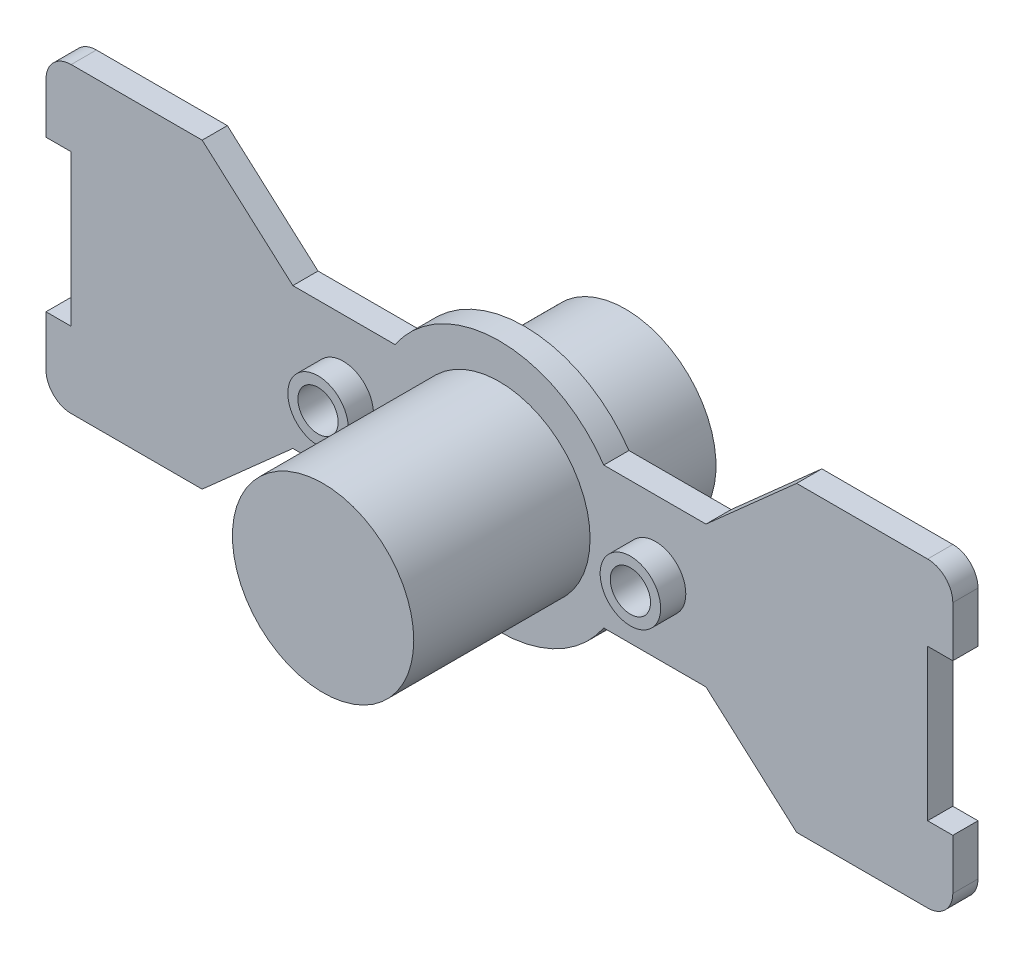
from build123d import *

# Parameters (mm, degrees)
EXTRUDE_1_DEPTH     = 5
SKETCH_2_R          = 18
EXTRUDE_2_DEPTH     = 35
EXTRUDE_START       = 20
SKETCH_3_R          = 18
EXTRUDE_3_DEPTH     = 20
SKETCH_4_R          = 15
CUT_EXTRUDE_1_DEPTH = 55
SKETCH_5_R          = 6
SKETCH_5_R_2        = 4
EXTRUDE_4_DEPTH     = 5
CUT_EXTRUDE_2_REACH = 103.119
SKETCH_6_R          = 4
FILLET_1_R          = 5


with BuildPart() as part:
    # 草图1 → 凸台-拉伸1 (new body)
    with BuildSketch(Plane.XY):
        with BuildLine():
            Line((-20.712315177, 14), (-41, 14))
            Line((-41, 14), (-59, 30))
            Line((-59, 30), (-90, 30))
            Line((-90, 30), (-90, 15))
            Line((-90, 15), (-85, 15))
            Line((-85, 15), (-85, -15))
            Line((-85, -15), (-90, -15))
            Line((-90, -15), (-90, -30))
            Line((-90, -30), (-59, -30))
            Line((-59, -30), (-41, -14))
            Line((-41, -14), (-20.712315177, -14))
            ThreePointArc((-20.712315177, -14), (0, -25), (20.712315177, -14))
            Line((20.712315177, -14), (41, -14))
            Line((41, -14), (59, -30))
            Line((59, -30), (90, -30))
            Line((90, -30), (90, -15))
            Line((90, -15), (85, -15))
            Line((85, -15), (85, 15))
            Line((85, 15), (90, 15))
            Line((90, 15), (90, 30))
            Line((90, 30), (59, 30))
            Line((59, 30), (41, 14))
            Line((41, 14), (20.712315177, 14))
            ThreePointArc((20.712315177, 14), (0, 25), (-20.712315177, 14))
        make_face()
    extrude(amount=EXTRUDE_1_DEPTH)

    # 草图2 → 凸台-拉伸2 (add)
    with BuildSketch(Plane.XY.offset(5)):
        Circle(SKETCH_2_R)
    extrude(amount=EXTRUDE_2_DEPTH)

    # 草图3 → 凸台-拉伸3 (add)
    with BuildSketch(Plane(origin=(0, 0, 0), x_dir=(-1, 0, 0), z_dir=(0, 0, -1)).offset(EXTRUDE_START)):
        with Locations(Location((0, 0, 0), (0, 0, 180))):
            Circle(SKETCH_3_R)
    extrude(amount=-EXTRUDE_3_DEPTH)

    # 草图4 → 切除-拉伸1 (cut)
    with BuildSketch(Plane(origin=(0, 0, -20), x_dir=(-1, 0, 0), z_dir=(0, 0, -1))):
        Circle(SKETCH_4_R)
    extrude(amount=-CUT_EXTRUDE_1_DEPTH, mode=Mode.SUBTRACT)

    # 草图5 → 凸台-拉伸4 (add)
    # profile 1 of 2: a face of its own
    with BuildSketch(Plane.XY.offset(5)):
        with Locations((-31, 0)):
            Circle(SKETCH_5_R)
        with Locations((-31, 0)):
            Circle(SKETCH_5_R_2, mode=Mode.SUBTRACT)
    # profile 2 of 2: a face of its own
    with BuildSketch(Plane.XY.offset(5)):
        with Locations((31, 0)):
            Circle(SKETCH_5_R)
        with Locations((31, 0)):
            Circle(SKETCH_5_R_2, mode=Mode.SUBTRACT)
    extrude(amount=EXTRUDE_4_DEPTH)

    # 草图6 → 切除-拉伸2 (cut, up to next)
    with BuildSketch(Plane.XY.offset(5), mode=Mode.PRIVATE) as cut_extrude_2_sk1:
        with Locations((31, 0)):
            Circle(SKETCH_6_R)
    cut_extrude_2_tool1 = extrude(cut_extrude_2_sk1.sketch, amount=-CUT_EXTRUDE_2_REACH, mode=Mode.PRIVATE) & part.part
    # 草图6 → 切除-拉伸2 (cut, up to next)
    with BuildSketch(Plane.XY.offset(5), mode=Mode.PRIVATE) as cut_extrude_2_sk2:
        with Locations((-31, 0)):
            Circle(SKETCH_6_R)
    cut_extrude_2_tool2 = extrude(cut_extrude_2_sk2.sketch, amount=-CUT_EXTRUDE_2_REACH, mode=Mode.PRIVATE) & part.part
    add(cut_extrude_2_tool1.solids().sort_by_distance((31, 0, 5))[0], mode=Mode.SUBTRACT)
    add(cut_extrude_2_tool2.solids().sort_by_distance((-31, 0, 5))[0], mode=Mode.SUBTRACT)

    # 圆角1
    fillet_1_edges = [part.edges().sort_by_distance(p)[0] for p in [
        (90, 30, 2.5),
        (90, -30, 2.5),
        (-90, -30, 2.5),
        (-90, 30, 2.5),
    ]]
    fillet(fillet_1_edges, radius=FILLET_1_R)


solid = part.part
